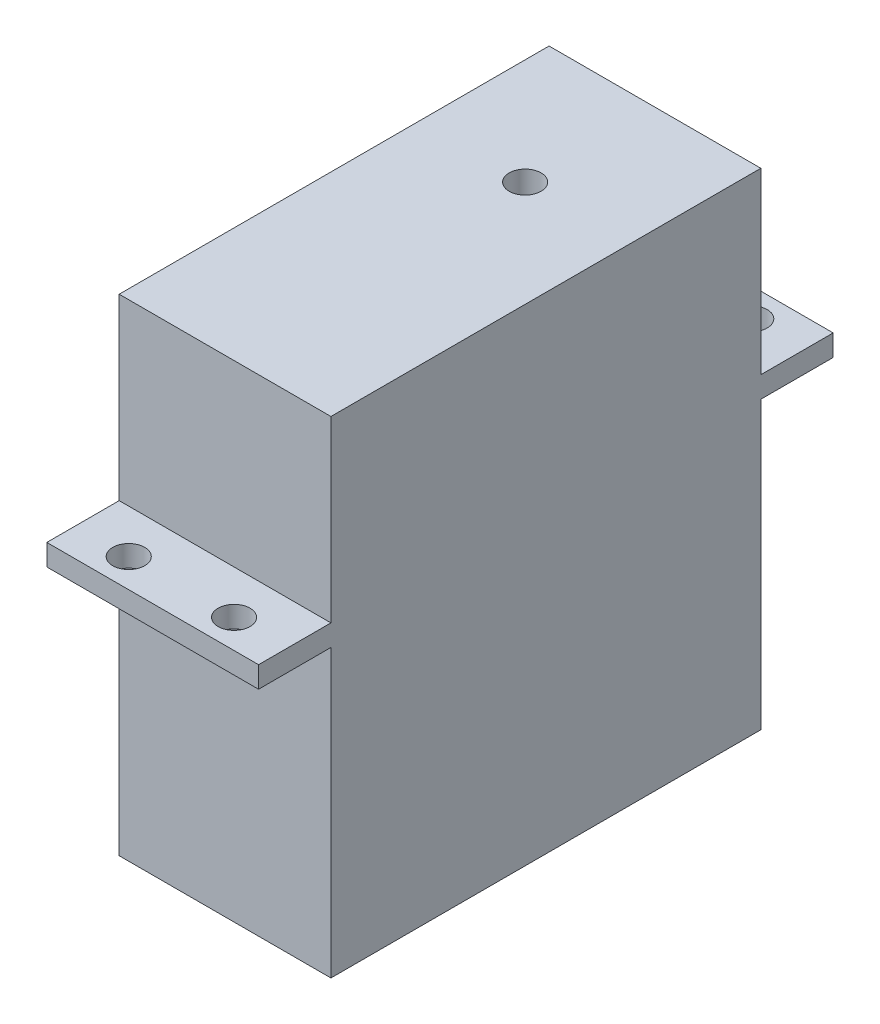
from build123d import *

# Parameters (mm, degrees)
SKETCH_1_W          = 19.9
SKETCH_1_H          = 40.4
EXTRUDE_1_DEPTH     = 45.7
SKETCH_2_W          = 19.9
SKETCH_2_H          = 2
EXTRUDE_2_DEPTH     = 27
SKETCH_3_R          = 1.5
CUT_EXTRUDE_1_DEPTH = 3
SKETCH_5_R          = 1.5
CUT_EXTRUDE_2_DEPTH = 41.782502375


with BuildPart() as part:
    # 草图1 → 凸台-拉伸1 (new body)
    with BuildSketch(Plane(origin=(0, 0, 0), x_dir=(1, 0, 0), z_dir=(0, 1, 0))):
        Rectangle(SKETCH_1_W, SKETCH_1_H)
    extrude(amount=EXTRUDE_1_DEPTH)

    # 草图2 → 凸台-拉伸2 (add, symmetric)
    with BuildSketch(Plane.XY):
        with Locations((0, 27.9)):
            Rectangle(SKETCH_2_W, SKETCH_2_H)
    extrude(amount=EXTRUDE_2_DEPTH, both=True)

    # 草图3 → 切除-拉伸1 (cut)
    with BuildSketch(Plane(origin=(0, 45.7, 0), x_dir=(1, 0, 0), z_dir=(0, 1, 0))):
        with Locations(Location((0, 8, 0), (0, 0, 270))):
            Circle(SKETCH_3_R)
    extrude(amount=-CUT_EXTRUDE_1_DEPTH, mode=Mode.SUBTRACT)

    # 草图5 → 切除-拉伸2 (cut, through all)
    with BuildSketch(Plane(origin=(0, 28.9, 0), x_dir=(1, 0, 0), z_dir=(0, 1, 0))):
        with Locations(Location((-4.95, 24.3, 0), (0, 0, 270))):
            Circle(SKETCH_5_R)
        with Locations(Location((4.95, 24.3, 0), (0, 0, 270))):
            Circle(SKETCH_5_R)
        with Locations(Location((-4.95, -24.3, 0), (0, 0, 270))):
            Circle(SKETCH_5_R)
        with Locations(Location((4.95, -24.3, 0), (0, 0, 270))):
            Circle(SKETCH_5_R)
    extrude(amount=-CUT_EXTRUDE_2_DEPTH, mode=Mode.SUBTRACT)


solid = part.part
